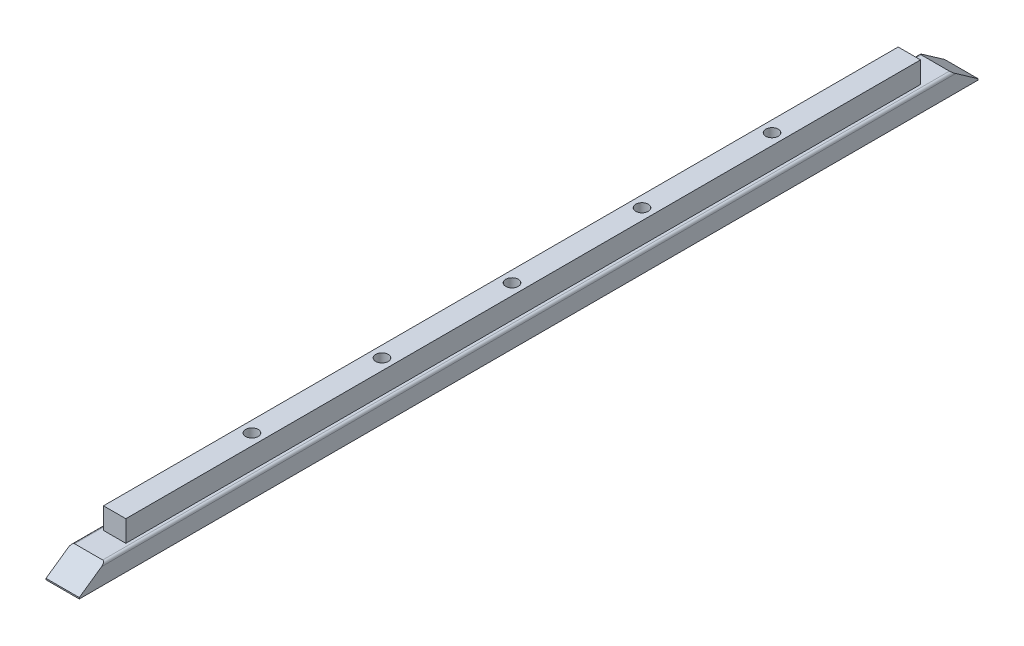
from build123d import *

# Parameters (mm, degrees)
SKETCH1_W                                       = 6.4
SKETCH1_H                                       = 172.8
BOSS_EXTRUDE1_DEPTH                             = 3.75
CHAMFER4_SIZE                                   = 5
CHAMFER4_SIZE2                                  = 3.501037691
FILLET1_R                                       = 0.5
SKETCH2_W                                       = 4.3
SKETCH2_H                                       = 152.8
BOSS_EXTRUDE2_DEPTH                             = 4.1
CSK_FOR_M2_FLAT_HEAD_MACHINE_SCREW1_D           = 2.4
CSK_FOR_M2_FLAT_HEAD_MACHINE_SCREW1_CSINK_D     = 4.4
CSK_FOR_M2_FLAT_HEAD_MACHINE_SCREW1_CSINK_ANGLE = 90
LPATTERN1_COUNT                                 = 3
LPATTERN1_PITCH                                 = 25
LPATTERN1_COL_COUNT                             = 3
LPATTERN1_COL_PITCH                             = 25


with BuildPart() as part:
    # Sketch1 → Boss-Extrude1 (new body)
    with BuildSketch(Plane(origin=(0, 0, 0), x_dir=(1, 0, 0), z_dir=(0, 1, 0))):
        with Locations((0, -76.4)):
            Rectangle(SKETCH1_W, SKETCH1_H)
    extrude(amount=BOSS_EXTRUDE1_DEPTH)

    # Chamfer4
    chamfer4_edges = [part.edges().sort_by_distance(p)[0] for p in [
        (0, 3.75, 162.8),
        (0, 3.75, -10),
    ]]
    chamfer4_side = [part.faces().sort_by_distance(p)[0] for p in [
        (0, 3.75, 76.4),
    ]]
    chamfer(chamfer4_edges, length=CHAMFER4_SIZE, length2=CHAMFER4_SIZE2, reference=chamfer4_side[0])

    # Fillet1
    fillet1_edges = [part.edges().sort_by_distance(p)[0] for p in [
        (-3.2, 3.75, 76.4),
        (3.2, 3.75, 76.4),
    ]]
    fillet(fillet1_edges, radius=FILLET1_R)

    # Sketch2 → Boss-Extrude2 (add)
    with BuildSketch(Plane(origin=(0, 3.75, 0), x_dir=(1, 0, 0), z_dir=(0, 1, 0))):
        with Locations((0, -76.4)):
            Rectangle(SKETCH2_W, SKETCH2_H)
    extrude(amount=BOSS_EXTRUDE2_DEPTH)

    # CSK for M2 Flat Head Machine Screw1 (through all)
    with Locations(Plane.XZ):
        with Locations((0, 76.4)):
            csk_for_m2_flat_head_machine_screw1 = CounterSinkHole(CSK_FOR_M2_FLAT_HEAD_MACHINE_SCREW1_D / 2, CSK_FOR_M2_FLAT_HEAD_MACHINE_SCREW1_CSINK_D / 2, counter_sink_angle=CSK_FOR_M2_FLAT_HEAD_MACHINE_SCREW1_CSINK_ANGLE)

    # LPattern1: CSK for M2 Flat Head Machine Screw1 ×3
    with Locations(*[(0, 0, -i * LPATTERN1_PITCH) for i in range(1, LPATTERN1_COUNT)]):
        add(csk_for_m2_flat_head_machine_screw1, mode=Mode.SUBTRACT)

    # LPattern1 col: CSK for M2 Flat Head Machine Screw1 ×3
    with Locations(*[(0, 0, i * LPATTERN1_COL_PITCH) for i in range(1, LPATTERN1_COL_COUNT)]):
        add(csk_for_m2_flat_head_machine_screw1, mode=Mode.SUBTRACT)


solid = part.part
